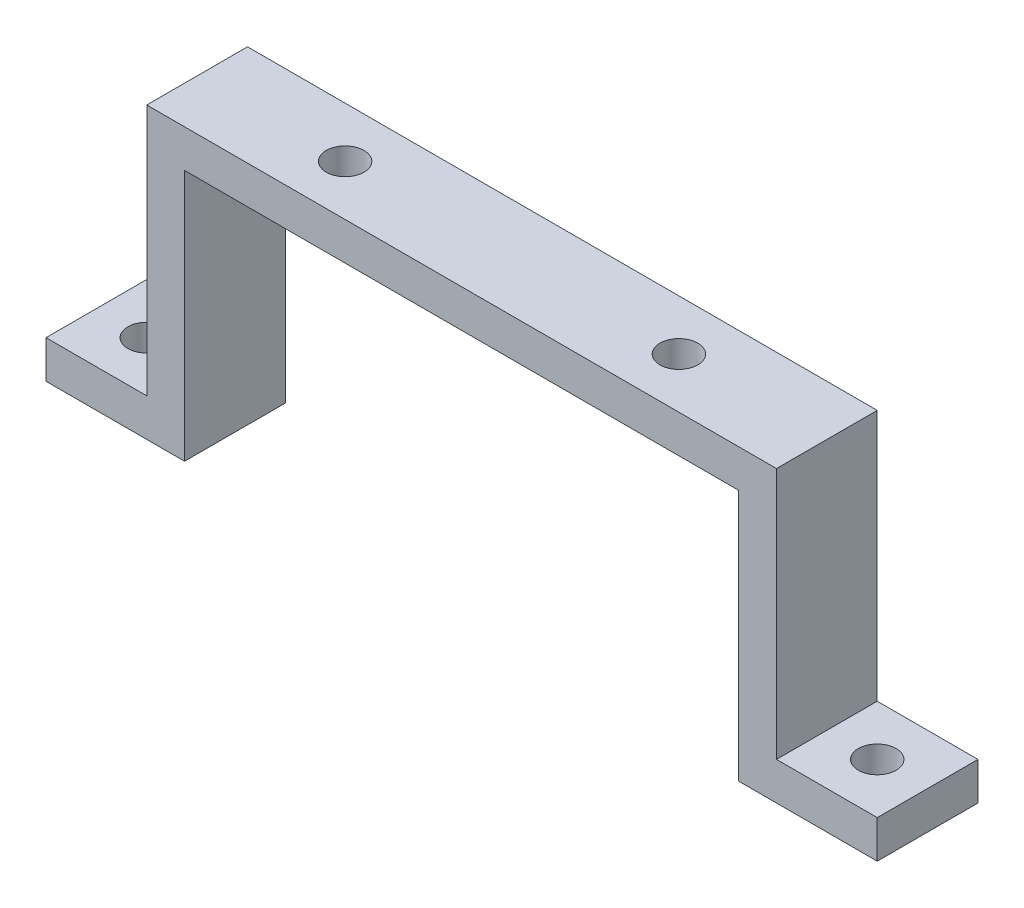
from build123d import *

# Parameters (mm, degrees)
SKETCH1_W           = 50
SKETCH1_H           = 8
SKETCH1_R           = 1.5
BOSS_EXTRUDE1_DEPTH = 3
SKETCH2_W           = 3
SKETCH2_H           = 8
BOSS_EXTRUDE2_DEPTH = 20
SKETCH3_W           = 8
SKETCH3_H           = 8
SKETCH3_R           = 1.5
BOSS_EXTRUDE3_DEPTH = 3


with BuildPart() as part:
    # Sketch1 → Boss-Extrude1 (new body)
    with BuildSketch(Plane(origin=(0, 0, 0), x_dir=(1, 0, 0), z_dir=(0, 1, 0))):
        Rectangle(SKETCH1_W, SKETCH1_H)
        with Locations(Location((-13.25, 0, 0), (0, 0, 270))):
            Circle(SKETCH1_R, mode=Mode.SUBTRACT)
        with Locations(Location((13.25, 0, 0), (0, 0, 270))):
            Circle(SKETCH1_R, mode=Mode.SUBTRACT)
    extrude(amount=BOSS_EXTRUDE1_DEPTH)

    # Sketch2 → Boss-Extrude2 (add)
    with BuildSketch(Plane.XZ):
        with Locations((-23.5, 0)):
            Rectangle(SKETCH2_W, SKETCH2_H)
    boss_extrude2 = extrude(amount=BOSS_EXTRUDE2_DEPTH)

    # Sketch3 → Boss-Extrude3 (add)
    with BuildSketch(Plane(origin=(0, -20, 0), x_dir=(-1, 0, 0), z_dir=(0, -1, 0))):
        with Locations((29, 0)):
            Rectangle(SKETCH3_W, SKETCH3_H)
        with Locations(Location((29, 0, 0), (0, 0, 90))):
            Circle(SKETCH3_R, mode=Mode.SUBTRACT)
    boss_extrude3 = extrude(amount=-BOSS_EXTRUDE3_DEPTH)

    # Mirror1: Boss-Extrude2, Boss-Extrude3 across plane
    add(boss_extrude2.mirror(Plane(origin=(0, 0, 0), x_dir=(0, 0, 1), z_dir=(1, 0, 0))))
    add(boss_extrude3.mirror(Plane(origin=(0, 0, 0), x_dir=(0, 0, 1), z_dir=(1, 0, 0))))


solid = part.part
